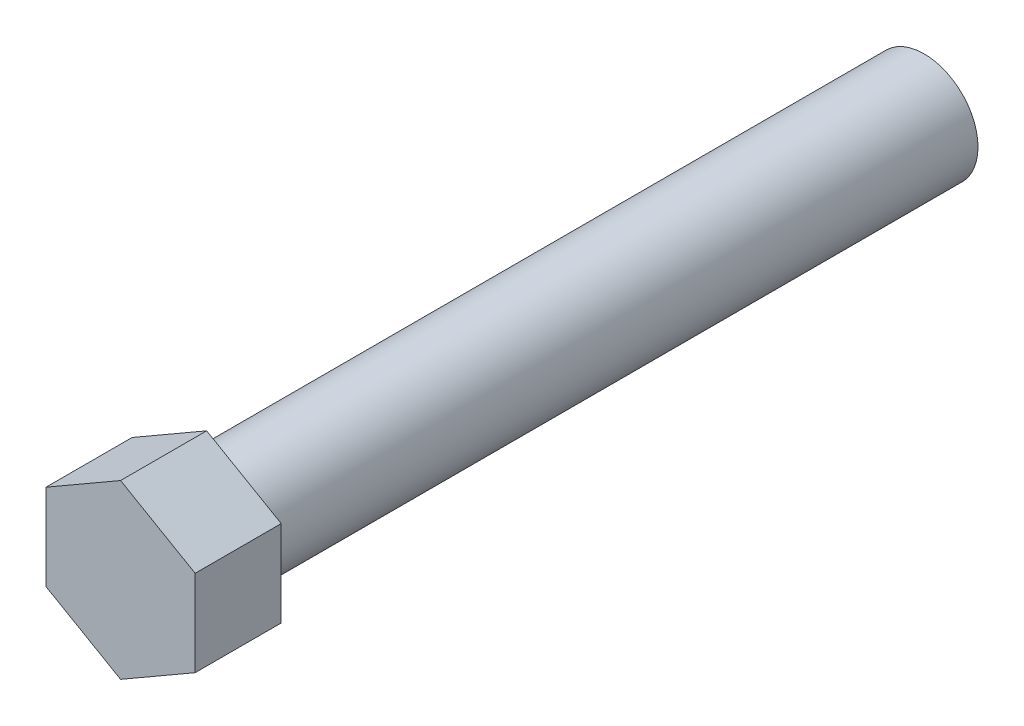
from build123d import *

# Parameters (mm, degrees)
SKETCH1_R           = 7.5
BOSS_EXTRUDE1_DEPTH = 100
BOSS_EXTRUDE2_DEPTH = 12


with BuildPart() as part:
    # Sketch1 → Boss-Extrude1 (new body)
    with BuildSketch(Plane.XY):
        Circle(SKETCH1_R)
    extrude(amount=BOSS_EXTRUDE1_DEPTH)

    # Sketch2 → Boss-Extrude2 (add)
    with BuildSketch(Plane.XY.offset(100)):
        Polygon((0, -12), (10.392304845, -6), (10.392304845, 6), (0, 12), (-10.392304845, 6), (-10.392304845, -6), align=None)
    extrude(amount=BOSS_EXTRUDE2_DEPTH)


solid = part.part
